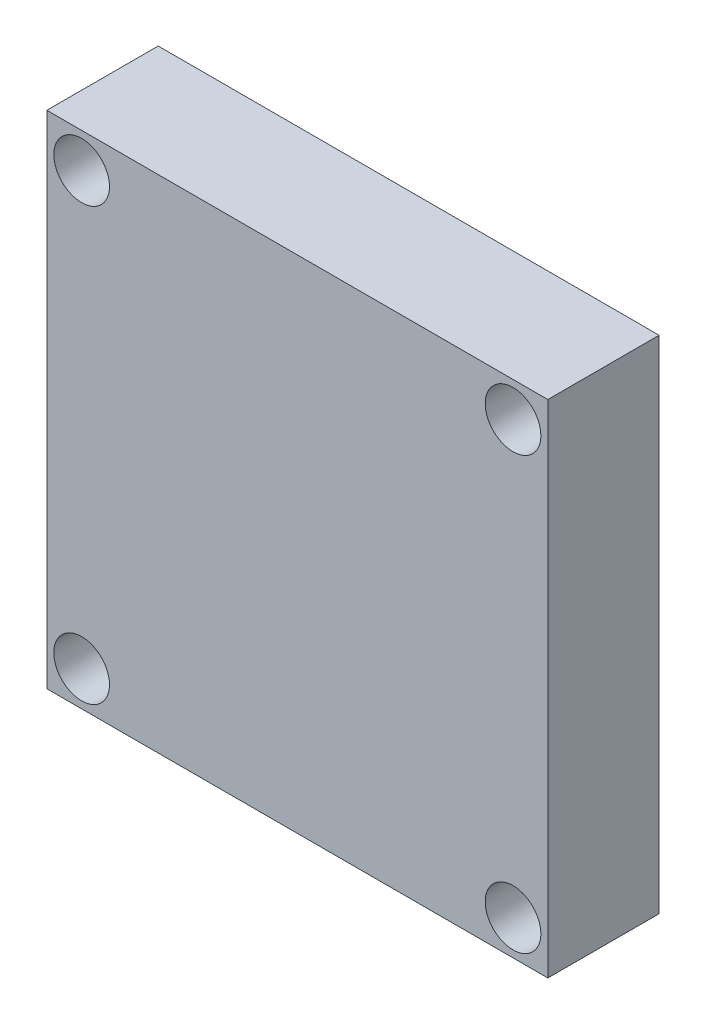
from build123d import *

# Parameters (mm, degrees)
SKETCH1_W           = 36
SKETCH1_H           = 36
SKETCH1_R           = 2
BOSS_EXTRUDE1_DEPTH = 4


with BuildPart() as part:
    # Sketch1 → Boss-Extrude1 (new, symmetric)
    with BuildSketch(Plane.XY):
        Rectangle(SKETCH1_W, SKETCH1_H)
        with Locations((-15.5, -15.5)):
            Circle(SKETCH1_R, mode=Mode.SUBTRACT)
        with Locations((15.5, -15.5)):
            Circle(SKETCH1_R, mode=Mode.SUBTRACT)
        with Locations((15.5, 15.5)):
            Circle(SKETCH1_R, mode=Mode.SUBTRACT)
        with Locations((-15.5, 15.5)):
            Circle(SKETCH1_R, mode=Mode.SUBTRACT)
    extrude(amount=BOSS_EXTRUDE1_DEPTH, both=True)


solid = part.part
